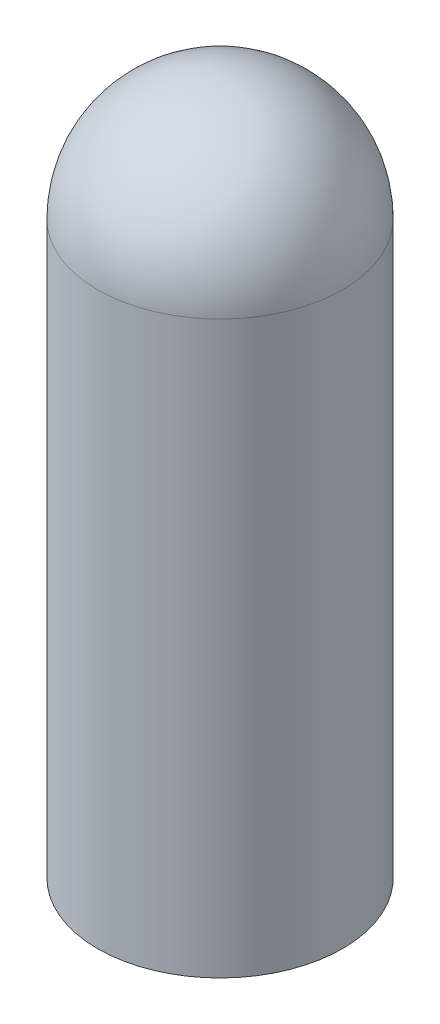
from build123d import *

# Parameters (mm, degrees)
SKETCH2_R          = 6.35
CUT_EXTRUDE1_DEPTH = 31.496


with BuildPart() as part:
    # Sketch1 → Revolve1 (revolve)
    with BuildSketch(Plane.XY, mode=Mode.PRIVATE) as revolve1_sk:
        with BuildLine():
            Line((-6.731, 0), (-6.731, 31.369))
            ThreePointArc((-6.731, 31.369), (-4.759535744, 36.128535744), (0, 38.1))
            Line((0, 38.1), (0, 0))
            Line((0, 0), (-6.731, 0))
        make_face()
    revolve(revolve1_sk.sketch.rotate(Axis((0, 0, 0), (0, -1, 0)), 270), axis=Axis((0, 0, 0), (0, -1, 0)))

    # Sketch2 → Cut-Extrude1 (cut)
    with BuildSketch(Plane.XZ):
        with Locations(Location((0, 0, 0), (0, 0, 270))):
            Circle(SKETCH2_R)
    extrude(amount=-CUT_EXTRUDE1_DEPTH, mode=Mode.SUBTRACT)


solid = part.part
